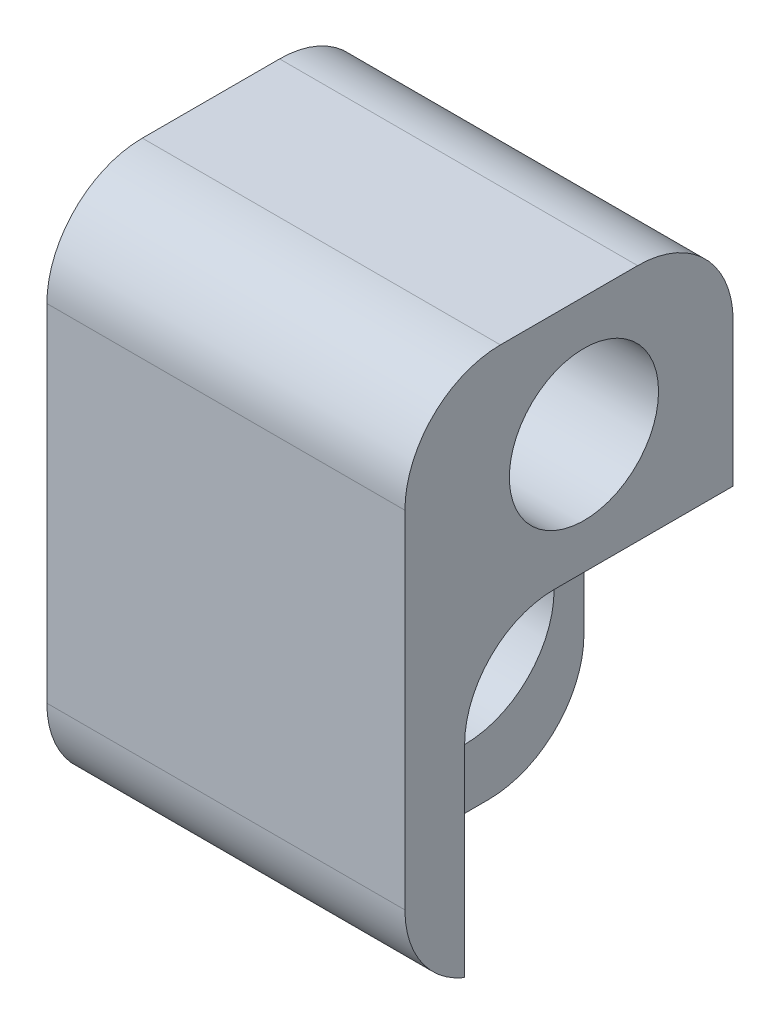
from build123d import *

# Parameters (mm, degrees)
SKETCH1_W           = 5.5
SKETCH1_H           = 9
SKETCH1_R           = 1.5
SKETCH1_R_2         = 1.25
BOSS_EXTRUDE1_DEPTH = 6
SKETCH2_W           = 4.5
SKETCH2_H           = 5
CUT_EXTRUDE1_DEPTH  = 2.5
FILLET1_R           = 1.5
FILLET2_R           = 1.6


with BuildPart() as part:
    # Sketch1 → Boss-Extrude1 (new body)
    with BuildSketch(Plane(origin=(0, 0, 0), x_dir=(0, 0, -1), z_dir=(1, 0, 0))):
        with Locations((2.75, 4.5)):
            Rectangle(SKETCH1_W, SKETCH1_H)
        with Locations((3.5, 2.5)):
            Circle(SKETCH1_R, mode=Mode.SUBTRACT)
        with Locations((3, 7)):
            Circle(SKETCH1_R_2, mode=Mode.SUBTRACT)
    extrude(amount=BOSS_EXTRUDE1_DEPTH)

    # Sketch2 → Cut-Extrude1 (cut)
    with BuildSketch(Plane(origin=(6, 0, 0), x_dir=(0, 0, -1), z_dir=(1, 0, 0))):
        with Locations((3.25, 2.5)):
            Rectangle(SKETCH2_W, SKETCH2_H)
    extrude(amount=-CUT_EXTRUDE1_DEPTH, mode=Mode.SUBTRACT)

    # Fillet1
    fillet1_edges = [part.edges().sort_by_distance(p)[0] for p in [
        (4.75, 5, -1),
    ]]
    fillet(fillet1_edges, radius=FILLET1_R)

    # Fillet2
    fillet2_edges = [part.edges().sort_by_distance(p)[0] for p in [
        (3, 9, 0),
        (3, 0, 0),
        (1.75, 0, -5.5),
        (3, 9, -5.5),
    ]]
    fillet(fillet2_edges, radius=FILLET2_R)


solid = part.part
